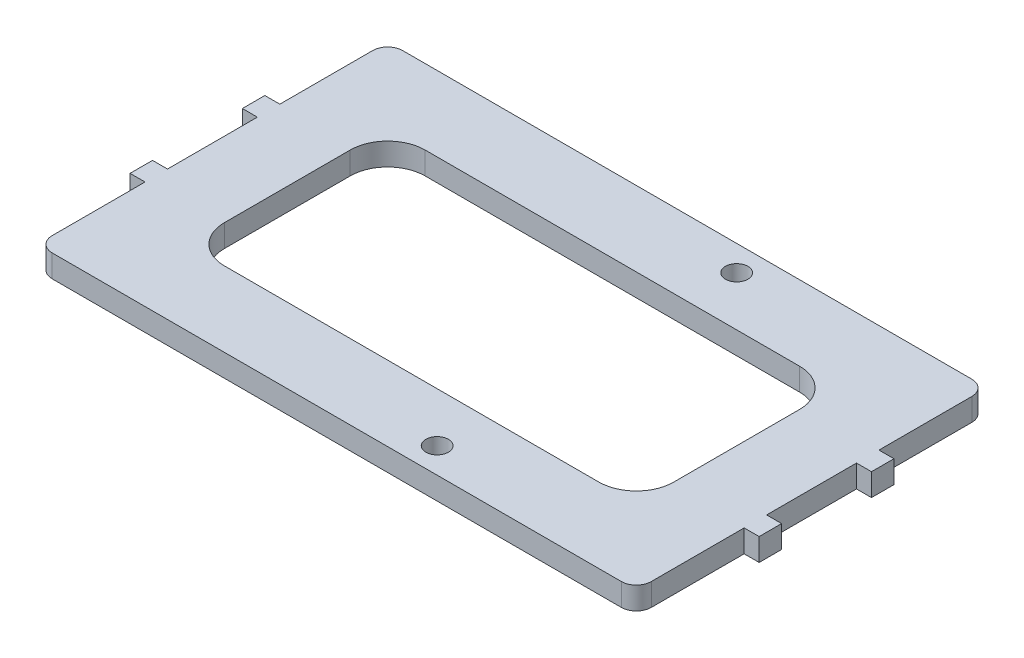
from build123d import *

# Parameters (mm, degrees)
SKETCH1_W                       = 101.6
SKETCH1_H                       = 59.436
BASE_EXTRUDE_DEPTH              = 3.81
BASE_CORNER_FILLET_R            = 2.54
SKETCH3_W                       = 3.81
SKETCH3_H                       = 3.81
PEG_EXTRUDE_DEPTH               = 2.54
MATERIAL_REMOVAL_CUT_DEPTH      = 120.96788652
SKETCH5_R                       = 1.905
REMOTE_CONTROL_HOLDER_CUT_DEPTH = 120.96788652


with BuildPart() as part:
    # Sketch1 → Base Extrude (new body)
    with BuildSketch(Plane(origin=(0, 0, 0), x_dir=(1, 0, 0), z_dir=(0, 1, 0))):
        with Locations((50.8, 29.718)):
            Rectangle(SKETCH1_W, SKETCH1_H)
    extrude(amount=BASE_EXTRUDE_DEPTH)

    # Base Corner Fillet
    base_corner_fillet_edges = [part.edges().sort_by_distance(p)[0] for p in [
        (0, 1.905, -59.436),
        (101.6, 1.905, -59.436),
        (101.6, 1.905, 0),
        (0, 1.905, 0),
    ]]
    fillet(base_corner_fillet_edges, radius=BASE_CORNER_FILLET_R)

    # Sketch3 → Peg Extrude (add)
    with BuildSketch(Plane.ZY):
        with Locations((-20.193, 1.905)):
            Rectangle(SKETCH3_W, SKETCH3_H)
        with Locations((-39.243, 1.905)):
            Rectangle(SKETCH3_W, SKETCH3_H)
    peg_extrude = extrude(amount=PEG_EXTRUDE_DEPTH)

    # Peg Mirror: Peg Extrude across plane
    add(peg_extrude.mirror(Plane(origin=(50.8, 0, 0), x_dir=(0, 0, 1), z_dir=(1, 0, 0))))

    # Sketch4 → Material Removal Cut (cut, through all)
    with BuildSketch(Plane.XZ):
        with BuildLine():
            Line((19.05, -12.7), (82.55, -12.7))
            ThreePointArc((82.55, -12.7), (87.040128061, -14.559871939), (88.9, -19.05))
            Line((88.9, -19.05), (88.9, -40.386))
            ThreePointArc((88.9, -40.386), (87.040128061, -44.876128061), (82.55, -46.736))
            Line((82.55, -46.736), (19.05, -46.736))
            ThreePointArc((19.05, -46.736), (14.559871939, -44.876128061), (12.7, -40.386))
            Line((12.7, -40.386), (12.7, -19.05))
            ThreePointArc((12.7, -19.05), (14.559871939, -14.559871939), (19.05, -12.7))
        make_face()
    extrude(amount=-MATERIAL_REMOVAL_CUT_DEPTH, mode=Mode.SUBTRACT)

    # Sketch5 → Remote Control Holder Cut (cut, through all)
    with BuildSketch(Plane(origin=(0, 3.81, 0), x_dir=(1, 0, 0), z_dir=(0, 1, 0))):
        with Locations(Location((63.5, 4.318, 0), (0, 0, 270))):
            Circle(SKETCH5_R)
        with Locations(Location((63.5, 55.118, 0), (0, 0, 270))):
            Circle(SKETCH5_R)
    extrude(amount=-REMOTE_CONTROL_HOLDER_CUT_DEPTH, mode=Mode.SUBTRACT)


solid = part.part
